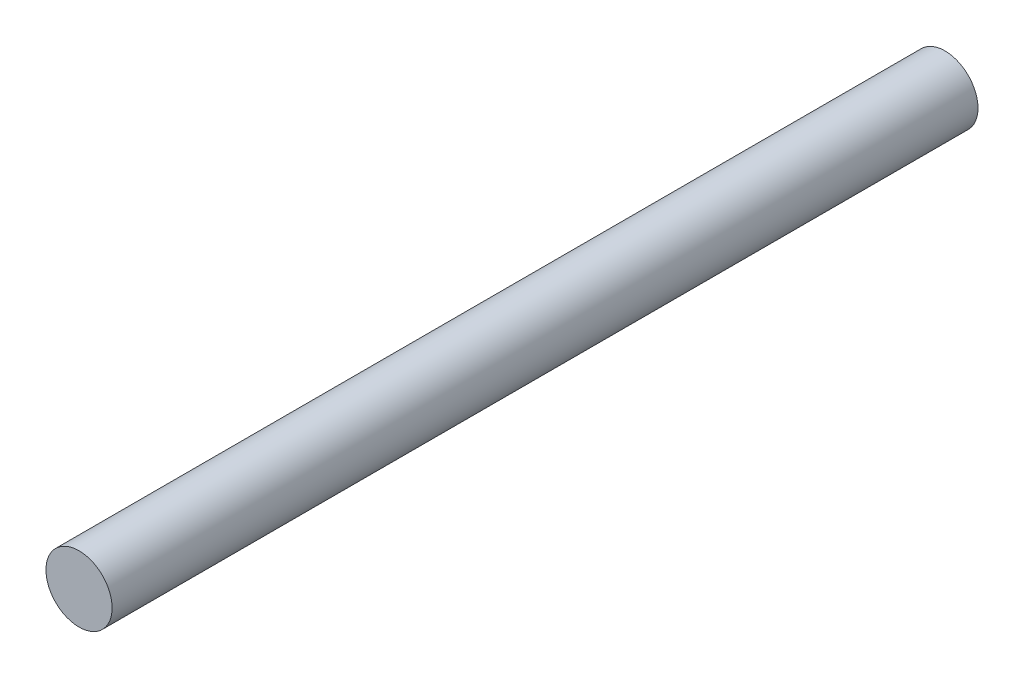
from build123d import *

# Parameters (mm, degrees)
SKETCH1_R           = 3
BOSS_EXTRUDE1_DEPTH = 39.25


with BuildPart() as part:
    # Sketch1 → Boss-Extrude1 (new, symmetric)
    with BuildSketch(Plane.XY):
        Circle(SKETCH1_R)
    extrude(amount=BOSS_EXTRUDE1_DEPTH, both=True)


solid = part.part
